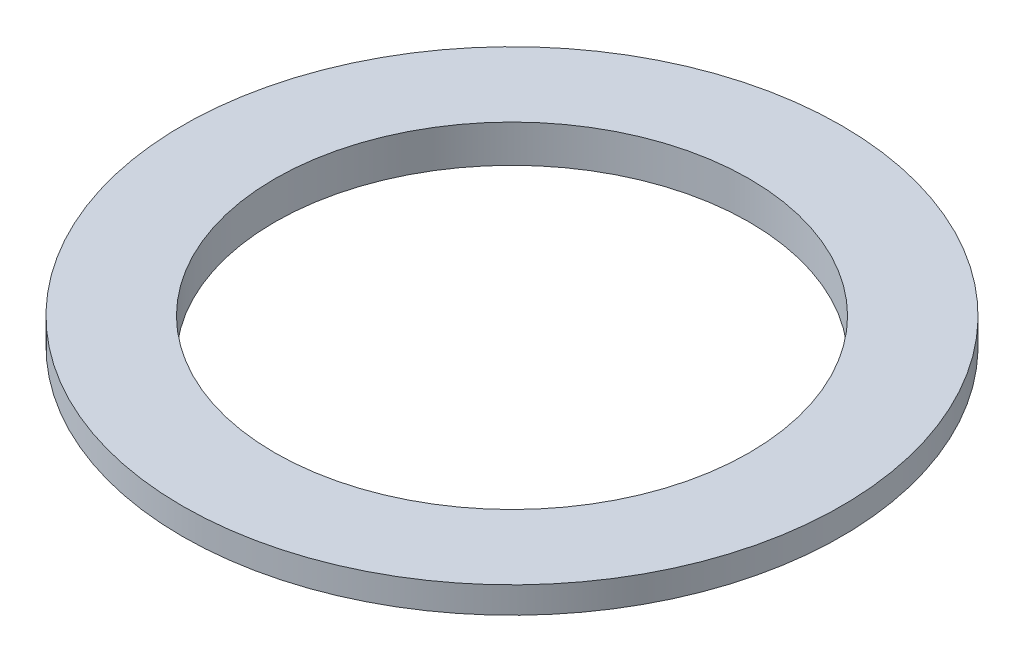
from build123d import *

# Parameters (mm, degrees)
SKETCH1_R           = 138.05066916
SKETCH1_R_2         = 114.3
BOSS_EXTRUDE1_DEPTH = 5.349999936
SKETCH2_R           = 158.75
SKETCH2_R_2         = 114.3
BOSS_EXTRUDE2_DEPTH = 12.7


with BuildPart() as part:
    # Sketch1 → Boss-Extrude1 (new body)
    with BuildSketch(Plane(origin=(0, 0, 0), x_dir=(1, 0, 0), z_dir=(0, 1, 0))):
        with Locations(Location((0, 0, 0), (0, 0, 270))):
            Circle(SKETCH1_R)
        with Locations(Location((0, 0, 0), (0, 0, 270))):
            Circle(SKETCH1_R_2, mode=Mode.SUBTRACT)
    extrude(amount=BOSS_EXTRUDE1_DEPTH)

    # Sketch2 → Boss-Extrude2 (add)
    with BuildSketch(Plane(origin=(0, 5.349999936, 0), x_dir=(1, 0, 0), z_dir=(0, 1, 0))):
        with Locations(Location((0, 0, 0), (0, 0, 270))):
            Circle(SKETCH2_R)
        with Locations(Location((0, 0, 0), (0, 0, 270))):
            Circle(SKETCH2_R_2, mode=Mode.SUBTRACT)
    extrude(amount=BOSS_EXTRUDE2_DEPTH)


solid = part.part
